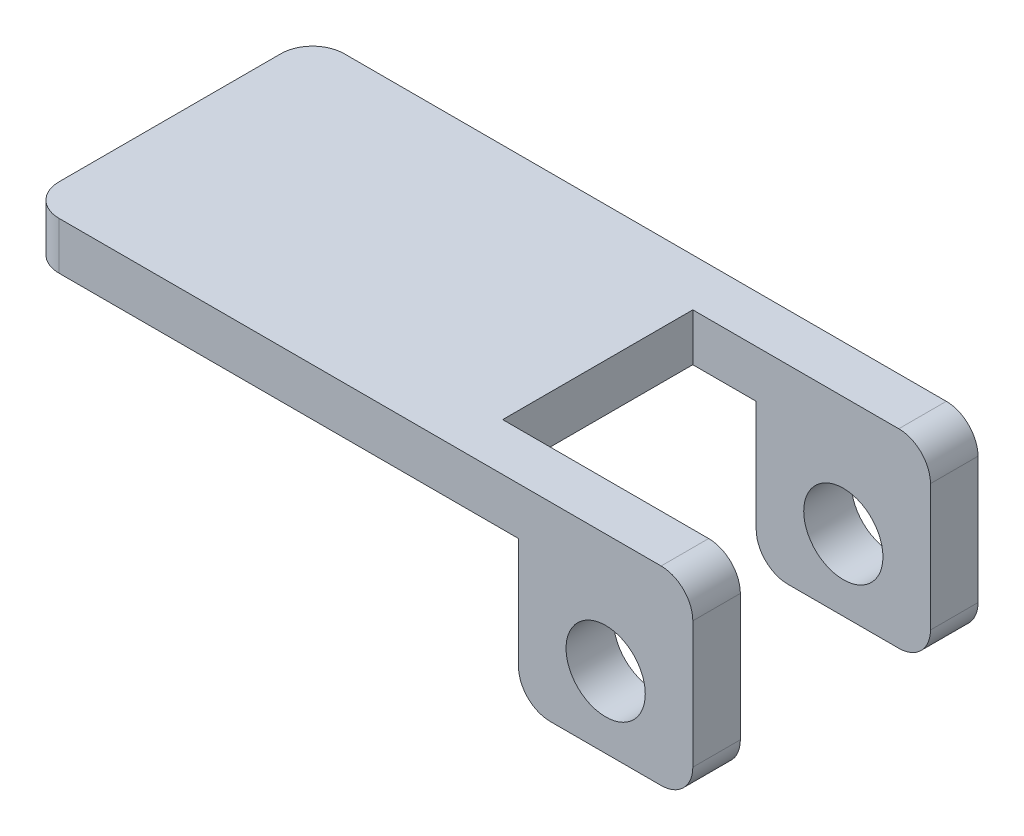
from build123d import *

# Parameters (mm, degrees)
SKETCH1_W           = 42
SKETCH1_H           = 18
BOSS_EXTRUDE1_DEPTH = 3
SKETCH2_W           = 11
SKETCH2_H           = 3
BOSS_EXTRUDE2_DEPTH = 9
SKETCH3_R           = 2.5
CUT_EXTRUDE1_DEPTH  = 47.572524089
SKETCH4_W           = 15
SKETCH4_H           = 12
CUT_EXTRUDE2_DEPTH  = 3
FILLET1_R           = 2
FILLET2_R           = 2


with BuildPart() as part:
    # Sketch1 → Boss-Extrude1 (new body)
    with BuildSketch(Plane(origin=(0, 0, 0), x_dir=(1, 0, 0), z_dir=(0, 1, 0))):
        with Locations((21, 9)):
            Rectangle(SKETCH1_W, SKETCH1_H)
    extrude(amount=BOSS_EXTRUDE1_DEPTH)

    # Sketch2 → Boss-Extrude2 (add)
    with BuildSketch(Plane.XZ):
        with Locations((36.5, -1.5)):
            Rectangle(SKETCH2_W, SKETCH2_H)
        with Locations((36.5, -16.5)):
            Rectangle(SKETCH2_W, SKETCH2_H)
    extrude(amount=BOSS_EXTRUDE2_DEPTH)

    # Sketch3 → Cut-Extrude1 (cut, through all)
    with BuildSketch(Plane.XY):
        with Locations((36.5, -4.5)):
            Circle(SKETCH3_R)
    extrude(amount=-CUT_EXTRUDE1_DEPTH, mode=Mode.SUBTRACT)

    # Sketch4 → Cut-Extrude2 (cut)
    with BuildSketch(Plane(origin=(0, 3, 0), x_dir=(1, 0, 0), z_dir=(0, 1, 0))):
        with Locations((34.5, 9)):
            Rectangle(SKETCH4_W, SKETCH4_H)
    extrude(amount=-CUT_EXTRUDE2_DEPTH, mode=Mode.SUBTRACT)

    # Fillet1
    fillet1_edges = [part.edges().sort_by_distance(p)[0] for p in [
        (0, 1.5, -18),
        (0, 1.5, 0),
    ]]
    fillet(fillet1_edges, radius=FILLET1_R)

    # Fillet2
    fillet2_edges = [part.edges().sort_by_distance(p)[0] for p in [
        (42, 3, -1.5),
        (42, -9, -1.5),
        (31, -9, -1.5),
        (42, -9, -16.5),
        (31, -9, -16.5),
        (42, 3, -16.5),
    ]]
    fillet(fillet2_edges, radius=FILLET2_R)


solid = part.part
